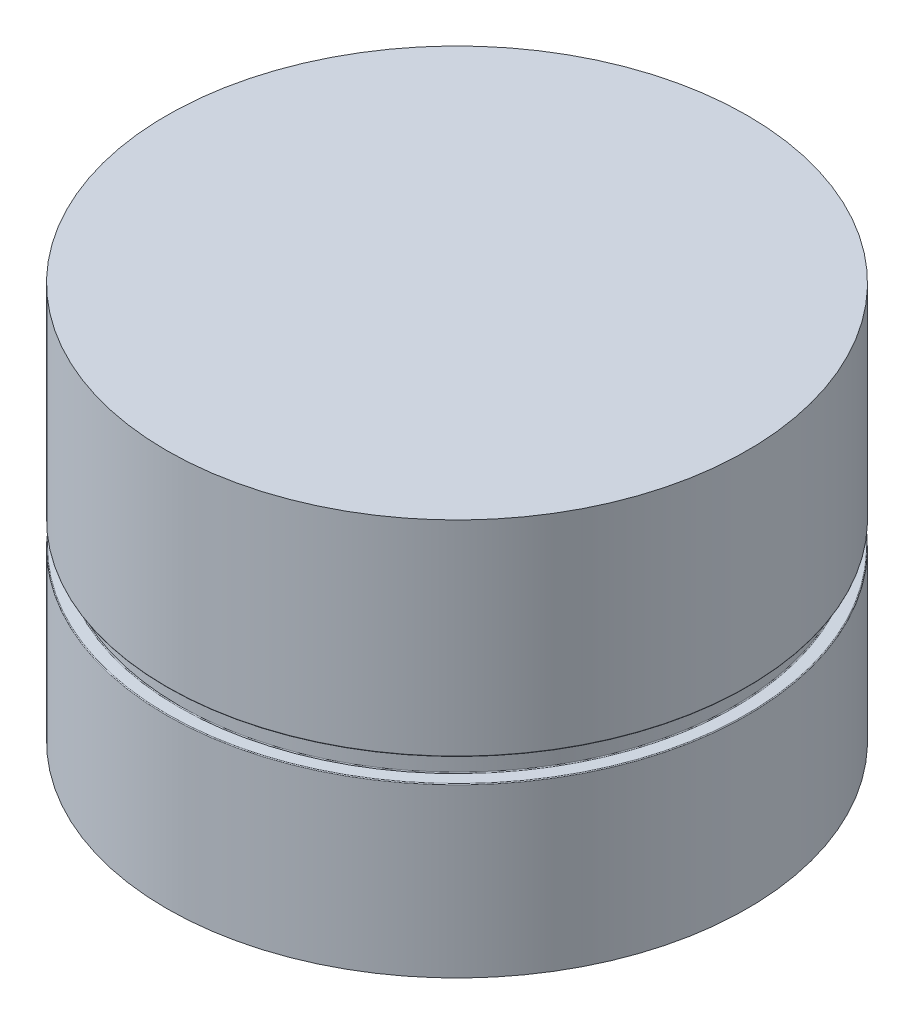
from build123d import *

# Parameters (mm, degrees)
FILLET1_R = 0.127
FILLET2_R = 0.127


with BuildPart() as part:
    # Sketch1 → Revolve3 (revolve)
    with BuildSketch(Plane.XY, mode=Mode.PRIVATE) as revolve3_sk:
        Polygon((0, -33.404421277), (-46.4693, -33.404421277), (-46.4693, -6.520721208), (-44.4373, -6.414228601), (-44.4373, -2.858228601), (-46.4693, -2.751735993), (-46.4693, 30.095578723), (0, 30.095578723), align=None)
    revolve(revolve3_sk.sketch.rotate(Axis((0, 32.189409805, 0), (0, -1, 0)), 270), axis=Axis((0, 32.189409805, 0), (0, -1, 0)))

    # Fillet1
    fillet1_edges = [part.edges().sort_by_distance(p)[0] for p in [
        (0, -2.751735993, -46.4693),
        (0, -6.520721208, -46.4693),
    ]]
    fillet(fillet1_edges, radius=FILLET1_R)

    # Fillet2
    fillet2_edges = [part.edges().sort_by_distance(p)[0] for p in [
        (0, -2.858228601, -44.4373),
        (0, -6.414228601, -44.4373),
    ]]
    fillet(fillet2_edges, radius=FILLET2_R)


solid = part.part
